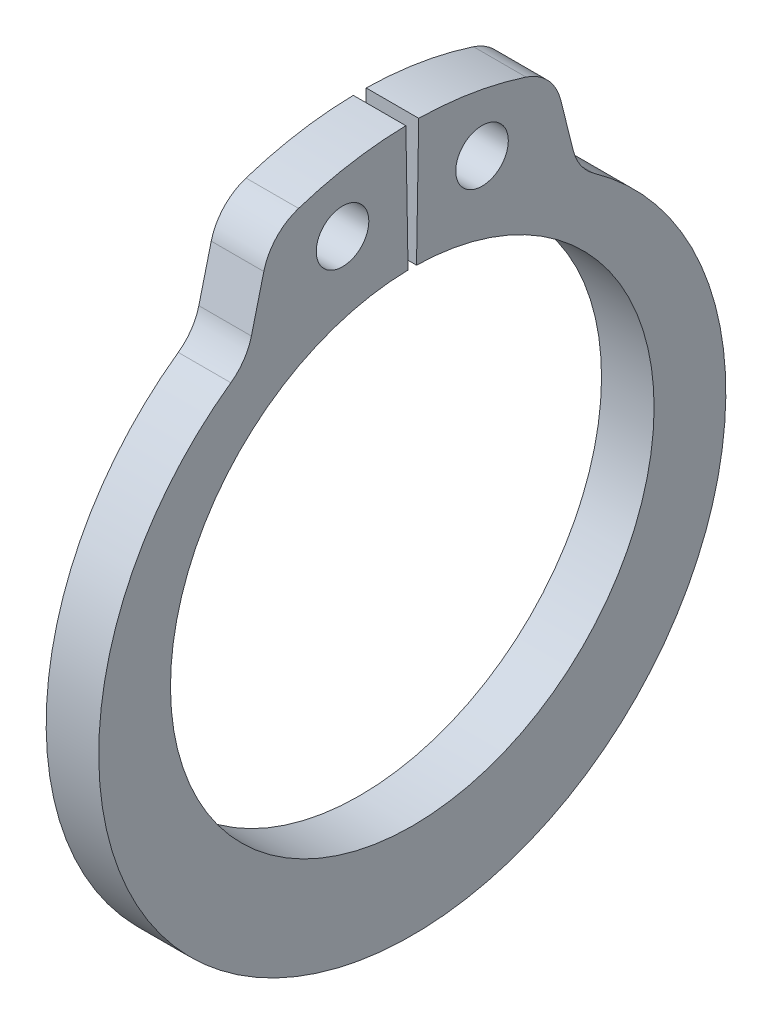
from build123d import *

# Parameters (mm, degrees)
SKETCH1_R      = 0.635
EXTRUDE1_DEPTH = 0.635
FILLET1_R      = 1.27


with BuildPart() as part:
    # Sketch1 → Extrude1 (new, symmetric)
    with BuildSketch(Plane(origin=(0, 0, 0), x_dir=(0, 0, -1), z_dir=(1, 0, 0))):
        with BuildLine():
            Line((-0.101956958, 5.841110235), (-0.155151893, 8.88864601))
            ThreePointArc((-0.155151893, 8.88864601), (-1.822675913, 8.701146621), (-3.425260789, 8.203638737))
            Line((-3.425260789, 8.203638737), (-4.005394532, 5.876849381))
            ThreePointArc((-4.005394532, 5.876849381), (0, -8.128), (4.005394532, 5.876849381))
            Line((4.005394532, 5.876849381), (3.425260789, 8.203638737))
            ThreePointArc((3.425260789, 8.203638737), (1.822675913, 8.701146621), (0.155151893, 8.88864601))
            Line((0.155151893, 8.88864601), (0.101956958, 5.841110235))
            ThreePointArc((0.101956958, 5.841110235), (0, -5.842), (-0.101956958, 5.841110235))
        make_face()
        with Locations((-1.684986776, 7.337710495)):
            Circle(SKETCH1_R, mode=Mode.SUBTRACT)
        with Locations((1.684986776, 7.337710495)):
            Circle(SKETCH1_R, mode=Mode.SUBTRACT)
    extrude(amount=EXTRUDE1_DEPTH, both=True)

    # Fillet1
    fillet1_edges = [part.edges().sort_by_distance(p)[0] for p in [
        (0, 8.203638737, -3.425260789),
        (0, 5.876849381, -4.005394532),
        (0, 5.876849381, 4.005394532),
        (0, 8.203638737, 3.425260789),
    ]]
    fillet(fillet1_edges, radius=FILLET1_R)


solid = part.part
